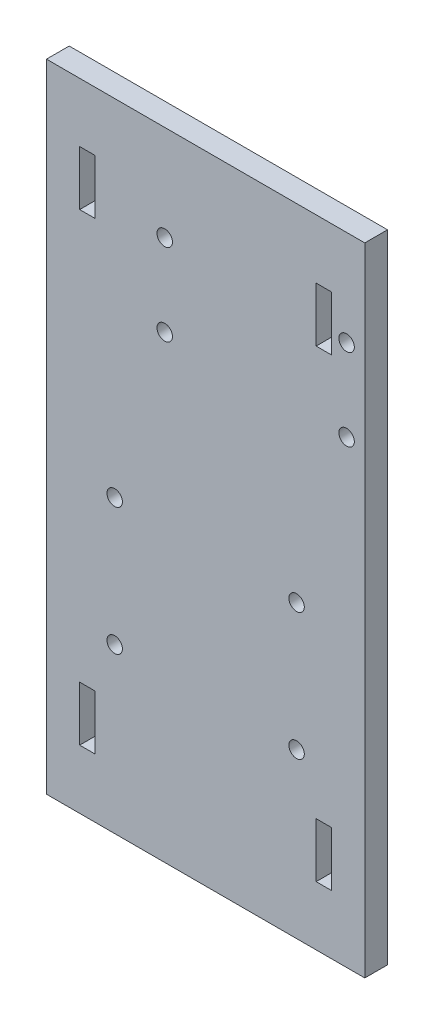
from build123d import *

# Parameters (mm, degrees)
SKETCH_1_W                                          = 70
SKETCH_1_H                                          = 140
BASE_70X140X5_DEPTH                                 = 5
CHASSIS_ADJUSTMENT_SLOTS_UNVERIFIED_POSI_DEPTH      = 79.421935707
CHASSIS_ADJUSTMENT_SLOTS_UNVERIFIED_POSI_DEPTH_BACK = 79.421935707
SKETCH_2_W                                          = 3.4
SKETCH_2_H                                          = 12
SUPPORT_AND_SERVO_MOUNT_M3_CLEARANCE_DEPTH          = 79.421935707
SUPPORT_AND_SERVO_MOUNT_M3_CLEARANCE_DEPTH_BACK     = 79.421935707
SKETCH_3_R                                          = 1.7


with BuildPart() as part:
    # 草图1 → Base_70x140x5 (new body)
    with BuildSketch(Plane.XY):
        Rectangle(SKETCH_1_W, SKETCH_1_H)
    extrude(amount=BASE_70X140X5_DEPTH)

    # 草图2 → Chassis_adjustment_slots_UNVERIFIED_positions (cut, two sides: drawn at the far end of the back side and taken through both)
    with BuildSketch(Plane.XY.offset(-CHASSIS_ADJUSTMENT_SLOTS_UNVERIFIED_POSI_DEPTH_BACK)):
        with Locations((-26, -51)):
            Rectangle(SKETCH_2_W, SKETCH_2_H)
        with Locations((-26, 51)):
            Rectangle(SKETCH_2_W, SKETCH_2_H)
        with Locations((26, -51)):
            Rectangle(SKETCH_2_W, SKETCH_2_H)
        with Locations((26, 51)):
            Rectangle(SKETCH_2_W, SKETCH_2_H)
    extrude(amount=CHASSIS_ADJUSTMENT_SLOTS_UNVERIFIED_POSI_DEPTH + CHASSIS_ADJUSTMENT_SLOTS_UNVERIFIED_POSI_DEPTH_BACK, mode=Mode.SUBTRACT)

    # 草图3 → Support_and_servo_mount_M3_clearance (cut, two sides: drawn at the far end of the back side and taken through both)
    with BuildSketch(Plane.XY.offset(-SUPPORT_AND_SERVO_MOUNT_M3_CLEARANCE_DEPTH_BACK)):
        with Locations((-20, -34)):
            Circle(SKETCH_3_R)
        with Locations((-20, -6)):
            Circle(SKETCH_3_R)
        with Locations((20, -34)):
            Circle(SKETCH_3_R)
        with Locations((20, -6)):
            Circle(SKETCH_3_R)
        with Locations((-9, 31)):
            Circle(SKETCH_3_R)
        with Locations((-9, 49)):
            Circle(SKETCH_3_R)
        with Locations((31, 31)):
            Circle(SKETCH_3_R)
        with Locations((31, 49)):
            Circle(SKETCH_3_R)
    extrude(amount=SUPPORT_AND_SERVO_MOUNT_M3_CLEARANCE_DEPTH + SUPPORT_AND_SERVO_MOUNT_M3_CLEARANCE_DEPTH_BACK, mode=Mode.SUBTRACT)


solid = part.part
